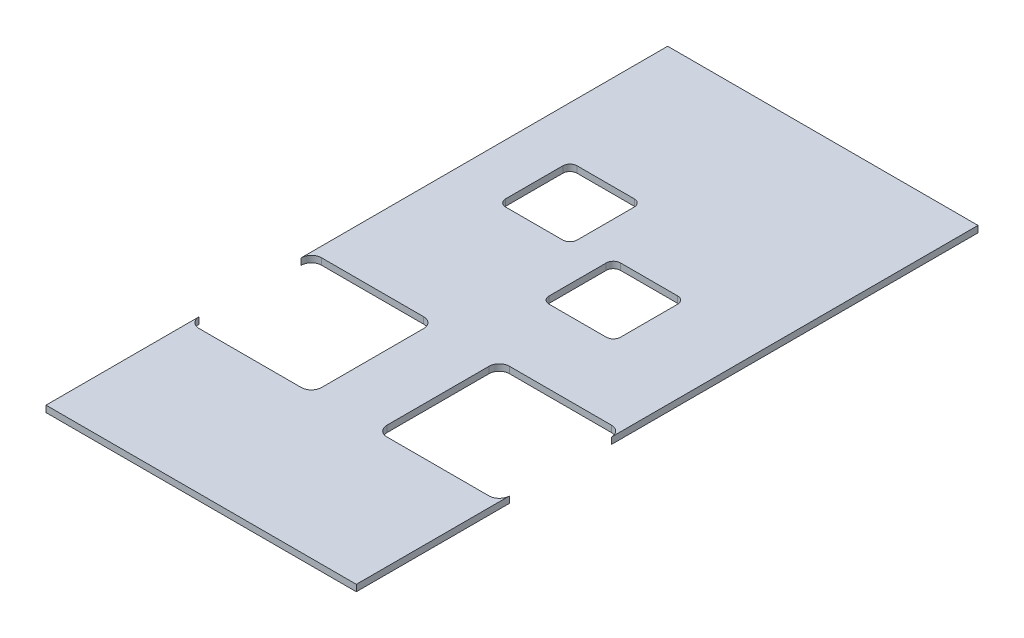
from build123d import *

# Parameters (mm, degrees)
SKETCH1_W           = 304
SKETCH1_H           = 609
BOSS_EXTRUDE1_DEPTH = 6.35
CUT_EXTRUDE1_DEPTH  = 386.382582119
CUT_EXTRUDE3_DEPTH  = 386.382582119


with BuildPart() as part:
    # Sketch1 → Boss-Extrude1 (new body)
    with BuildSketch(Plane(origin=(0, 0, 0), x_dir=(1, 0, 0), z_dir=(0, 1, 0))):
        with Locations((12.142011834, 44.121301775)):
            Rectangle(SKETCH1_W, SKETCH1_H)
    extrude(amount=BOSS_EXTRUDE1_DEPTH)

    # Sketch3 → Cut-Extrude1 (cut, through all)
    with BuildSketch(Plane(origin=(0, 6.35, 0), x_dir=(1, 0, 0), z_dir=(0, 1, 0))):
        with BuildLine():
            Line((154.142011834, -120.378698225), (54.142011834, -120.378698225))
            ThreePointArc((54.142011834, -120.378698225), (47.070944022, -117.449766037), (44.142011834, -110.378698225))
            Line((44.142011834, -110.378698225), (44.142011834, -10.378698225))
            ThreePointArc((44.142011834, -10.378698225), (47.070944022, -3.307630413), (54.142011834, -0.378698225))
            Line((54.142011834, -0.378698225), (154.142011834, -0.378698225))
            ThreePointArc((154.142011834, -0.378698225), (161.213079646, -3.307630413), (164.142011834, -10.378698225))
            Line((164.142011834, -10.378698225), (164.142011834, -110.378698225))
            ThreePointArc((164.142011834, -110.378698225), (161.213079646, -117.449766037), (154.142011834, -120.378698225))
        make_face()
        with BuildLine():
            Line((-129.857988166, -120.378698225), (-29.857988166, -120.378698225))
            ThreePointArc((-29.857988166, -120.378698225), (-22.786920354, -117.449766037), (-19.857988166, -110.378698225))
            Line((-19.857988166, -110.378698225), (-19.857988166, -10.378698225))
            ThreePointArc((-19.857988166, -10.378698225), (-22.786920354, -3.307630413), (-29.857988166, -0.378698225))
            Line((-29.857988166, -0.378698225), (-129.857988166, -0.378698225))
            ThreePointArc((-129.857988166, -0.378698225), (-136.929055978, -3.307630413), (-139.857988166, -10.378698225))
            Line((-139.857988166, -10.378698225), (-139.857988166, -110.378698225))
            ThreePointArc((-139.857988166, -110.378698225), (-136.929055978, -117.449766037), (-129.857988166, -120.378698225))
        make_face()
    extrude(amount=-CUT_EXTRUDE1_DEPTH, mode=Mode.SUBTRACT)

    # Sketch4 → Cut-Extrude3 (cut, through all)
    with BuildSketch(Plane(origin=(0, 6.35, 0), x_dir=(1, 0, 0), z_dir=(0, 1, 0))):
        with BuildLine():
            Line((20.906944625, 141.682393226), (76.906944625, 141.682393226))
            ThreePointArc((76.906944625, 141.682393226), (81.856692093, 139.632140694), (83.906944625, 134.682393226))
            Line((83.906944625, 134.682393226), (83.906944625, 78.682393226))
            ThreePointArc((83.906944625, 78.682393226), (81.856692093, 73.732645757), (76.906944625, 71.682393226))
            Line((76.906944625, 71.682393226), (20.906944625, 71.682393226))
            ThreePointArc((20.906944625, 71.682393226), (15.957197157, 73.732645757), (13.906944625, 78.682393226))
            Line((13.906944625, 78.682393226), (13.906944625, 134.682393226))
            ThreePointArc((13.906944625, 134.682393226), (15.957197157, 139.632140694), (20.906944625, 141.682393226))
        make_face()
        with BuildLine():
            Line((-82.776888169, 202.809428977), (-26.776888169, 202.809428977))
            ThreePointArc((-26.776888169, 202.809428977), (-21.8271407, 200.759176445), (-19.776888169, 195.809428977))
            Line((-19.776888169, 195.809428977), (-19.776888169, 139.809428977))
            ThreePointArc((-19.776888169, 139.809428977), (-21.8271407, 134.859681509), (-26.776888169, 132.809428977))
            Line((-26.776888169, 132.809428977), (-82.776888169, 132.809428977))
            ThreePointArc((-82.776888169, 132.809428977), (-87.726635637, 134.859681509), (-89.776888169, 139.809428977))
            Line((-89.776888169, 139.809428977), (-89.776888169, 195.809428977))
            ThreePointArc((-89.776888169, 195.809428977), (-87.726635637, 200.759176445), (-82.776888169, 202.809428977))
        make_face()
    extrude(amount=-CUT_EXTRUDE3_DEPTH, mode=Mode.SUBTRACT)


solid = part.part
